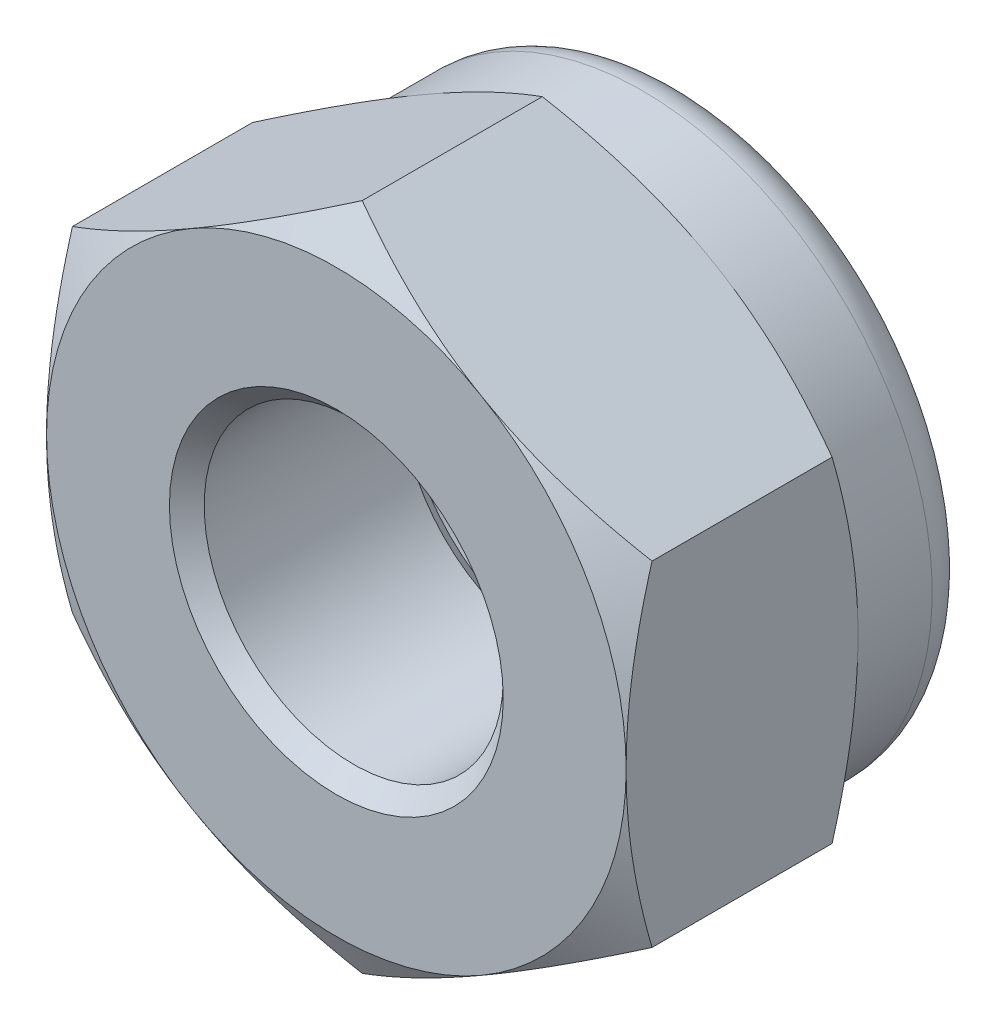
from build123d import *

# Parameters (mm, degrees)
SKETCH_1_R          = 2.58
EXTRUDE_1_DEPTH     = 4
SKETCH_5_R          = 5
SKETCH_5_R_2        = 3.3
EXTRUDE_4_DEPTH     = 2
FILLET_2_R          = 0.72
SKETCH_6_R          = 3.75
CUT_EXTRUDE_1_DEPTH = 0.5
CHAMFER_2_SIZE      = 0.3


with BuildPart() as part:
    # 草图1 → 凸台-拉伸1 (new body)
    with BuildSketch(Plane.XY):
        Polygon((0, 5.773502692), (-5, 2.886751346), (-5, -2.886751346), (0, -5.773502692), (5, -2.886751346), (5, 2.886751346), align=None)
        Circle(SKETCH_1_R, mode=Mode.SUBTRACT)
    extrude(amount=-EXTRUDE_1_DEPTH)

    # 草图2 → 切除-旋转1 (revolve, cut)
    with BuildSketch(Plane(origin=(0, 0, 0), x_dir=(0, 0, -1), z_dir=(1, 0, 0))):
        Polygon((0, 5), (0.446581987, 5.773502692), (0, 5.773502692), align=None)
        Polygon((4, 5), (3.553418013, 5.773502692), (4, 5.773502692), align=None)
    revolve(axis=Axis((0, 0, 0), (0, 0, -1)), mode=Mode.SUBTRACT)

    # 草图5 → 凸台-拉伸4 (add)
    with BuildSketch(Plane(origin=(0, 0, -4), x_dir=(-1, 0, 0), z_dir=(0, 0, -1))):
        Circle(SKETCH_5_R)
        Circle(SKETCH_5_R_2, mode=Mode.SUBTRACT)
    extrude(amount=EXTRUDE_4_DEPTH)

    # 圆角2
    fillet_2_edges = [part.edges().sort_by_distance(p)[0] for p in [
        (5, 0, -6),
    ]]
    fillet(fillet_2_edges, radius=FILLET_2_R)

    # 草图6 → 切除-拉伸1 (cut)
    with BuildSketch(Plane(origin=(0, 0, -6), x_dir=(-1, 0, 0), z_dir=(0, 0, -1))):
        Circle(SKETCH_6_R)
    extrude(amount=-CUT_EXTRUDE_1_DEPTH, mode=Mode.SUBTRACT)

    # 倒角2
    chamfer_2_edges = [part.edges().sort_by_distance(p)[0] for p in [
        (-2.58, 0, -4),
        (-2.58, 0, 0),
    ]]
    chamfer(chamfer_2_edges, length=CHAMFER_2_SIZE)


solid = part.part
